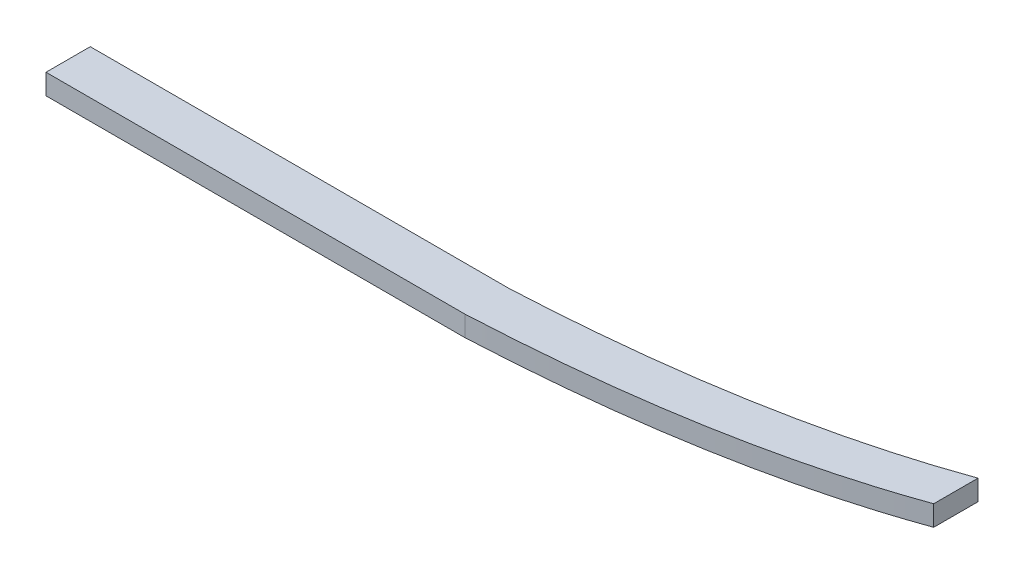
from build123d import *

# Parameters (mm, degrees)
BOSS_EXTRUDE1_DEPTH = 3


with BuildPart() as part:
    # Sketch1 → Boss-Extrude1 (new body)
    with BuildSketch(Plane(origin=(0, 0, 0), x_dir=(1, 0, 0), z_dir=(0, 1, 0))):
        with BuildLine():
            Line((0, 0), (61.5, 0))
            add(Edge.make_bspline(
                [(61.5, 0), (96.079868576, 1.689945504), (120.026085552, 10.3)],
                knots=[0, 0, 0, 1, 1, 1], degree=2))
            Line((120.026085552, 10.3), (120.028762053, 16.803234674))
            add(Edge.make_bspline(
                [(61.5, 6.5), (96.082545077, 8.193180177), (120.028762053, 16.803234674)],
                knots=[0, 0, 0, 1, 1, 1], degree=2))
            Line((61.5, 6.5), (0, 6.5))
            Line((0, 6.5), (0, 0))
        make_face()
    extrude(amount=BOSS_EXTRUDE1_DEPTH)


solid = part.part
